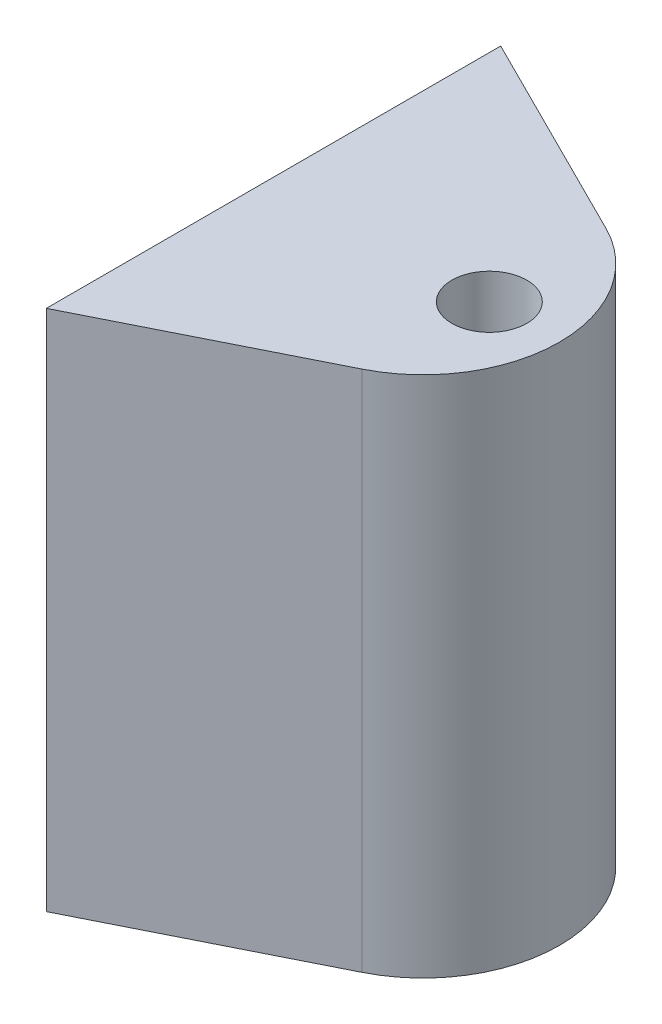
from build123d import *

# Parameters (mm, degrees)
BOSS_EXTRUDE1_DEPTH         = 23
FILLET1_R                   = 6
PREFORO_DA_MASCHIARE_M4_1_D = 3.3
BODY_MOVE_COPY1_ANGLE       = 90


with BuildPart() as part:
    # Sketch2 → Boss-Extrude1 (new body)
    with BuildSketch(Plane(origin=(0, 0, 0), x_dir=(0, 0, -1), z_dir=(1, 0, 0))):
        Polygon((-58.658771552, 3.364610889), (-38.658771552, 3.364610889), (-48.658771552, -16.635389111), align=None)
    extrude(amount=BOSS_EXTRUDE1_DEPTH)

    # Fillet1
    fillet1_edges = [part.edges().sort_by_distance(p)[0] for p in [
        (11.5, -16.635389111, 48.658771552),
    ]]
    fillet(fillet1_edges, radius=FILLET1_R)

    # Preforo da maschiare M4-1 (through all)
    with Locations(Plane.ZY):
        with Locations((48.658771552, -6.135389111)):
            Hole(PREFORO_DA_MASCHIARE_M4_1_D / 2)


with BuildPart() as part_1:
    # Body-Move/Copy1: moved
    add(part.part.rotate(Axis((10, -2.927185179, 0), (0, 0, 1)), BODY_MOVE_COPY1_ANGLE))


solid = part_1.part
